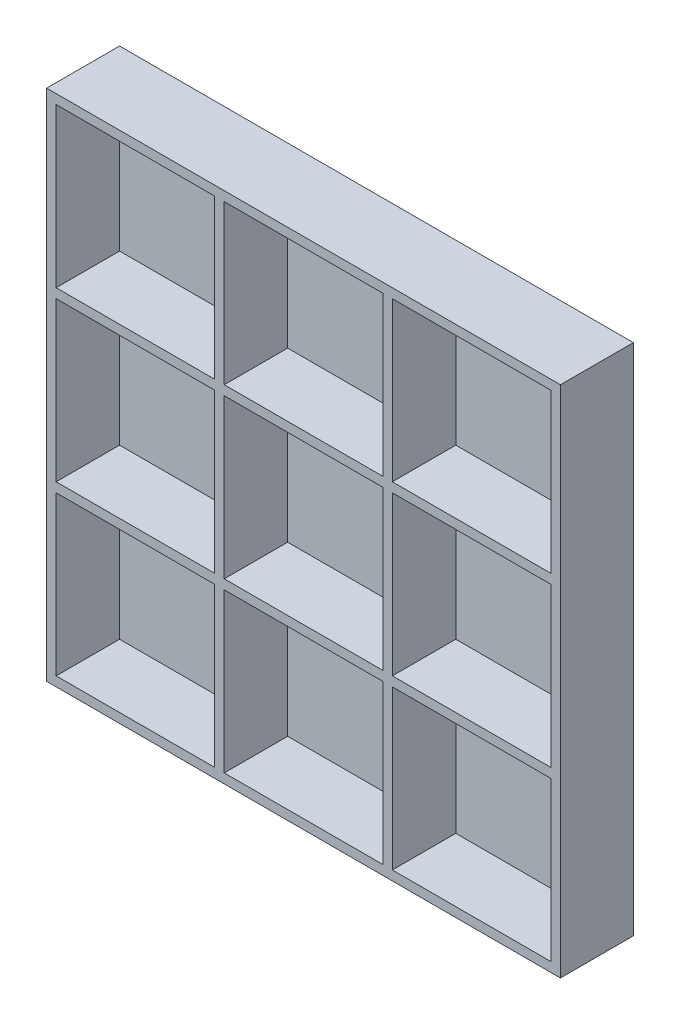
from build123d import *

# Parameters (mm, degrees)
SKETCH1_W           = 162
SKETCH1_H           = 162
SKETCH1_W_2         = 50
SKETCH1_H_2         = 50
BOSS_EXTRUDE1_DEPTH = 23
SKETCH1_2_W         = 162
SKETCH1_2_H         = 162
BOSS_EXTRUDE2_DEPTH = 3


with BuildPart() as part:
    # Sketch1 → Boss-Extrude1 (new body)
    with BuildSketch(Plane.XY):
        with Locations((2.220930233, -28.593023256)):
            Rectangle(SKETCH1_W, SKETCH1_H)
        with Locations((-50.779069767, 24.406976744)):
            Rectangle(SKETCH1_W_2, SKETCH1_H_2, mode=Mode.SUBTRACT)
        with Locations((2.220930233, 24.406976744)):
            Rectangle(SKETCH1_W_2, SKETCH1_H_2, mode=Mode.SUBTRACT)
        with Locations((55.220930233, 24.406976744)):
            Rectangle(SKETCH1_W_2, SKETCH1_H_2, mode=Mode.SUBTRACT)
        with Locations((-50.779069767, -28.593023256)):
            Rectangle(SKETCH1_W_2, SKETCH1_H_2, mode=Mode.SUBTRACT)
        with Locations((2.220930233, -28.593023256)):
            Rectangle(SKETCH1_W_2, SKETCH1_H_2, mode=Mode.SUBTRACT)
        with Locations((55.220930233, -28.593023256)):
            Rectangle(SKETCH1_W_2, SKETCH1_H_2, mode=Mode.SUBTRACT)
        with Locations((-50.779069767, -81.593023256)):
            Rectangle(SKETCH1_W_2, SKETCH1_H_2, mode=Mode.SUBTRACT)
        with Locations((2.220930233, -81.593023256)):
            Rectangle(SKETCH1_W_2, SKETCH1_H_2, mode=Mode.SUBTRACT)
        with Locations((55.220930233, -81.593023256)):
            Rectangle(SKETCH1_W_2, SKETCH1_H_2, mode=Mode.SUBTRACT)
    extrude(amount=BOSS_EXTRUDE1_DEPTH)

    # Sketch1<2> → Boss-Extrude2 (add)
    with BuildSketch(Plane.XY):
        with Locations((2.220930233, -28.593023256)):
            Rectangle(SKETCH1_2_W, SKETCH1_2_H)
    extrude(amount=BOSS_EXTRUDE2_DEPTH)


solid = part.part
